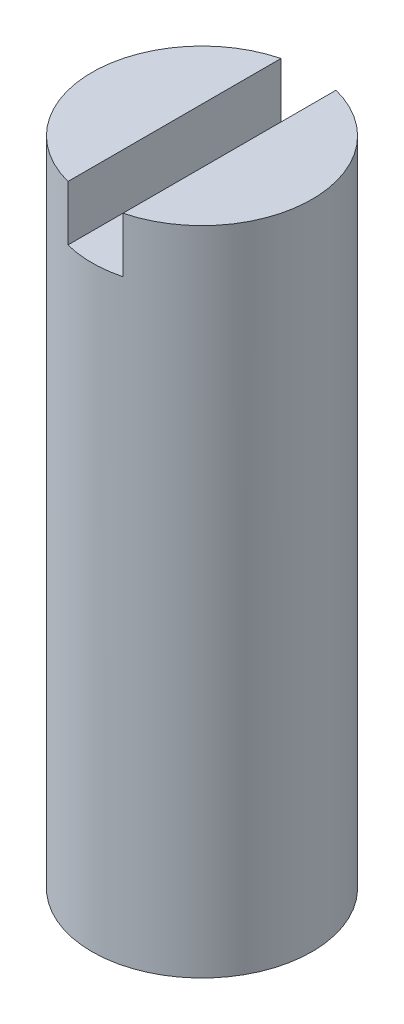
from build123d import *

# Parameters (mm, degrees)
SKETCH1_R           = 2
BOSS_EXTRUDE1_DEPTH = 13
CHAMFER1_SIZE       = 2
CHAMFER1_SIZE2      = 1.154700538
SKETCH2_W           = 1
SKETCH2_H           = 4.464568748
CUT_EXTRUDE1_DEPTH  = 1


with BuildPart() as part:
    # Sketch1 → Boss-Extrude1 (new body)
    with BuildSketch(Plane(origin=(0, 0, 0), x_dir=(1, 0, 0), z_dir=(0, 1, 0))):
        with Locations(Location((0, 0, 0), (0, 0, 90))):
            Circle(SKETCH1_R)
    extrude(amount=BOSS_EXTRUDE1_DEPTH)

    # Chamfer1
    chamfer1_edges = [part.edges().sort_by_distance(p)[0] for p in [
        (0, 0, 2),
    ]]
    chamfer1_side = [part.faces().sort_by_distance(p)[0] for p in [
        (0, 0, 0),
    ]]
    chamfer(chamfer1_edges, length=CHAMFER1_SIZE, length2=CHAMFER1_SIZE2, reference=chamfer1_side[0])

    # Sketch2 → Cut-Extrude1 (cut)
    with BuildSketch(Plane(origin=(0, 13, 0), x_dir=(1, 0, 0), z_dir=(0, 1, 0))):
        with Locations((0, -0.081308371)):
            Rectangle(SKETCH2_W, SKETCH2_H)
    extrude(amount=-CUT_EXTRUDE1_DEPTH, mode=Mode.SUBTRACT)


solid = part.part
